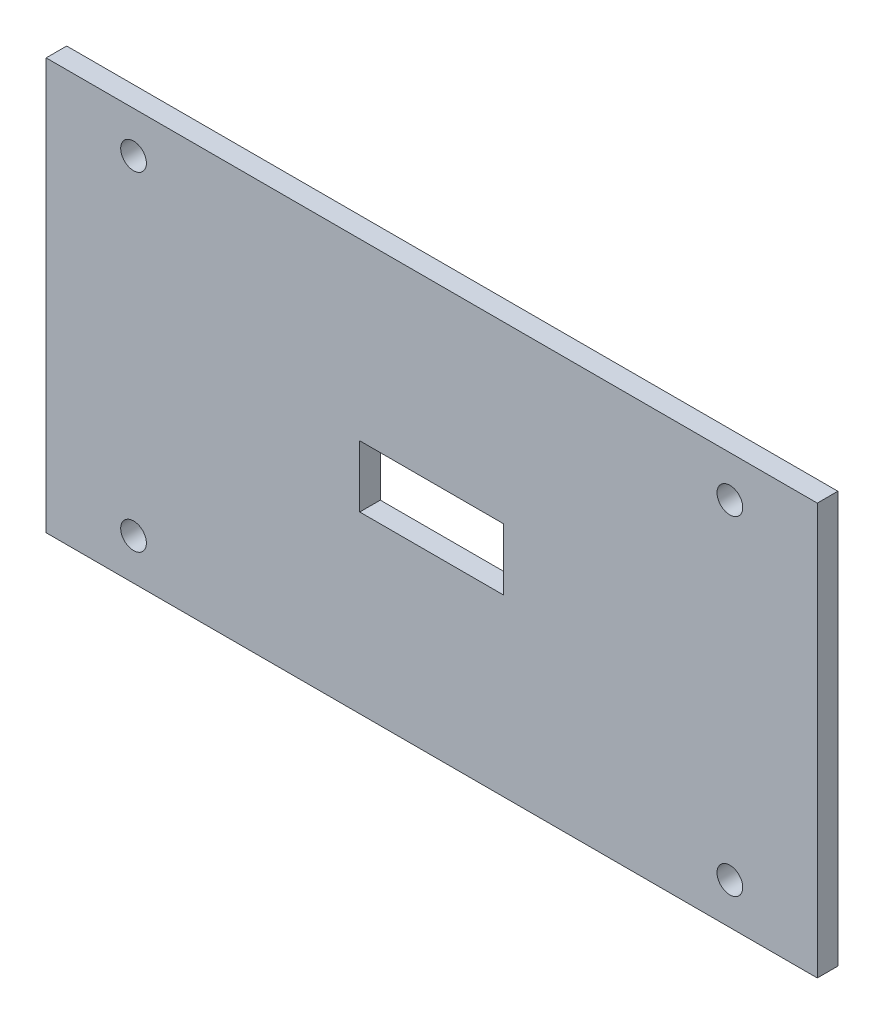
from build123d import *

# Parameters (mm, degrees)
ESBO_O1_W                = 150
ESBO_O1_H                = 80
ESBO_O1_R                = 2.5
ESBO_O1_W_2              = 28
ESBO_O1_H_2              = 12
RESSALTO_EXTRUS_O2_DEPTH = 4


with BuildPart() as part:
    # Esboço1 → Ressalto-extrusão2 (new body)
    with BuildSketch(Plane.XY):
        with Locations((25.444262425, 7.949915335)):
            Rectangle(ESBO_O1_W, ESBO_O1_H)
        with Locations((-32.555737575, 39.949915335)):
            Circle(ESBO_O1_R, mode=Mode.SUBTRACT)
        with Locations((-32.555737575, -24.050084665)):
            Circle(ESBO_O1_R, mode=Mode.SUBTRACT)
        with Locations((83.444262425, 39.949915335)):
            Circle(ESBO_O1_R, mode=Mode.SUBTRACT)
        with Locations((83.444262425, -24.050084665)):
            Circle(ESBO_O1_R, mode=Mode.SUBTRACT)
        with Locations((25.444262425, 7.949915335)):
            Rectangle(ESBO_O1_W_2, ESBO_O1_H_2, mode=Mode.SUBTRACT)
    extrude(amount=RESSALTO_EXTRUS_O2_DEPTH)


solid = part.part
